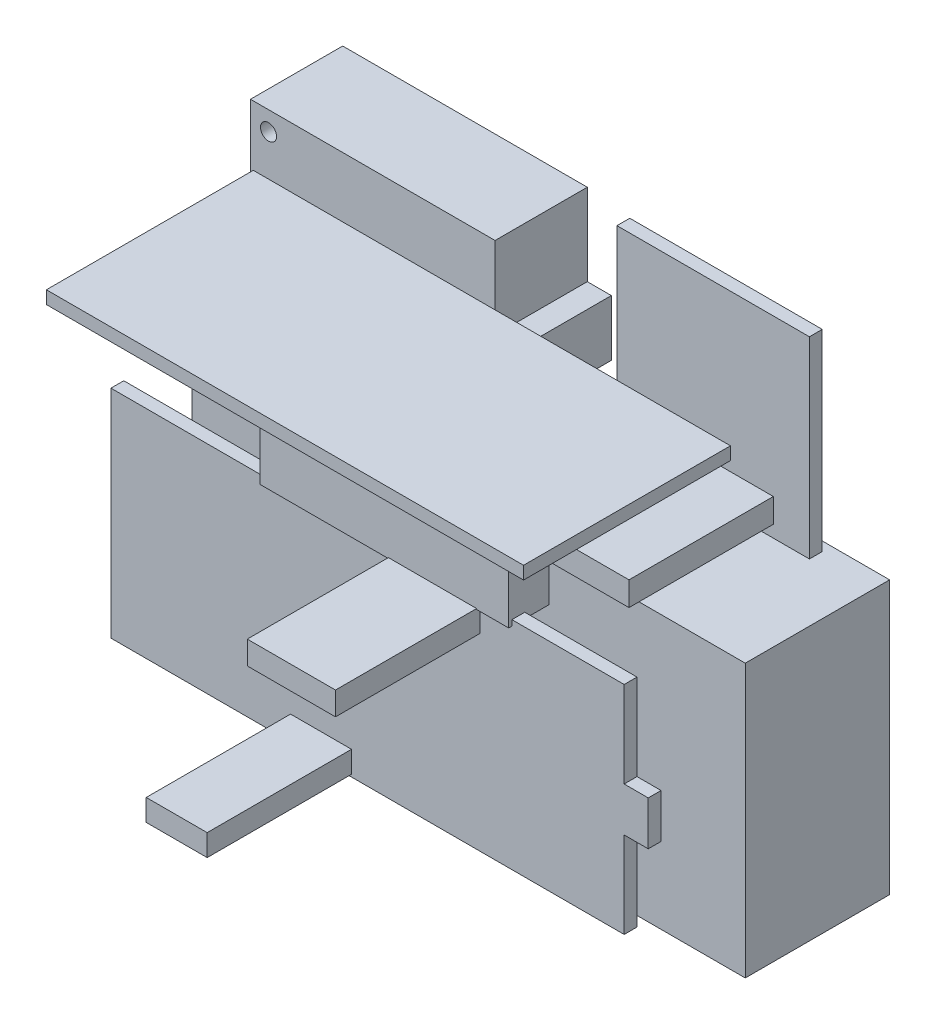
from build123d import *

# Parameters (mm, degrees)
BATTERY_START                              = 4
BATTERY_HOLDER_69_X_34_X_18_PROFILE_W      = 69
BATTERY_HOLDER_69_X_34_X_18_PROFILE_H      = 34
BATTERY_HOLDER_69_X_34_X_18_DEPTH          = 18
YBX_START                                  = 6.4
YBX_BOARD_24_X_24_PROFILE_W                = 24
YBX_BOARD_24_X_24_PROFILE_H                = 24
YBX_BOARD_24_X_24_DEPTH                    = 1.6
YBX_START_2                                = 8
YBX_JUMPER_ALLOWANCE_PROFILE_W             = 15
YBX_JUMPER_ALLOWANCE_PROFILE_H             = 3
YBX_JUMPER_ALLOWANCE_DEPTH                 = 18
GNSS_START                                 = 6.4
GNSS_11_5_MM_HIGH_3_MM_PROJECTION_2_R      = 1
GNSS_11_5_MM_HIGH_3_MM_PROJECTION_D2_DEPTH = 11.5
POWER_START                                = 19.1
POWER_BOARD_59_5_X_25_8_PROFILE_W          = 59.5
POWER_BOARD_59_5_X_25_8_PROFILE_H          = 1.6
POWER_BOARD_59_5_X_25_8_DEPTH              = 25.8
POWER_START_2                              = 30
POWER_HORIZONTAL_CONNECTOR_ALLOWANCE_PRO_W = 31
POWER_HORIZONTAL_CONNECTOR_ALLOWANCE_PRO_H = 16
POWER_HORIZONTAL_CONNECTOR_ALLOWANCE_DEPTH = 5
EORA_START                                 = 33
EORA_64_X_27_TOP_PROJECTION_3_X_5_5_DEPTH  = 1.6
EORA_START_2                               = 34.6
EORA_JUMPER_ALLOWANCE_A_PROFILE_W          = 7.6
EORA_JUMPER_ALLOWANCE_A_PROFILE_H          = 2.7
EORA_JUMPER_ALLOWANCE_A_DEPTH              = 18
EORA_JUMPER_ALLOWANCE_B_PROFILE_W          = 11
EORA_JUMPER_ALLOWANCE_B_PROFILE_H          = 2.9
EORA_JUMPER_ALLOWANCE_B_DEPTH              = 18


with BuildPart() as part:
    # Battery holder 69 x 34 x 18 profile → Battery holder 69 x 34 x 18 (new body)
    with BuildSketch(Plane.XY.offset(BATTERY_START)):
        with Locations((0, -12.75)):
            Rectangle(BATTERY_HOLDER_69_X_34_X_18_PROFILE_W, BATTERY_HOLDER_69_X_34_X_18_PROFILE_H)
    extrude(amount=BATTERY_HOLDER_69_X_34_X_18_DEPTH)


with BuildPart() as body_2:
    # YBX board 24 x 24 profile → YBX board 24 x 24 (new body)
    with BuildSketch(Plane.XY.offset(YBX_START)):
        with Locations((16.5, 17.5)):
            Rectangle(YBX_BOARD_24_X_24_PROFILE_W, YBX_BOARD_24_X_24_PROFILE_H)
    extrude(amount=YBX_BOARD_24_X_24_DEPTH)


with BuildPart() as body_3:
    # YBX jumper allowance profile → YBX jumper allowance (new body)
    with BuildSketch(Plane.XY.offset(YBX_START_2)):
        with Locations((16.5, 8.5)):
            Rectangle(YBX_JUMPER_ALLOWANCE_PROFILE_W, YBX_JUMPER_ALLOWANCE_PROFILE_H)
    extrude(amount=YBX_JUMPER_ALLOWANCE_DEPTH)


with BuildPart() as body_4:
    # GNSS 11.5 mm high - 3 mm projection  2 → GNSS 11.5 mm high - 3 mm projection - D2 (new body)
    with BuildSketch(Plane.XY.offset(GNSS_START)):
        Polygon((-31.3, 4.7), (-0.8, 4.7), (-0.8, 13), (2.2, 13), (2.2, 20), (-0.8, 20), (-0.8, 30.2), (-31.3, 30.2), align=None)
        with Locations((-29.05, 7)):
            Circle(GNSS_11_5_MM_HIGH_3_MM_PROJECTION_2_R, mode=Mode.SUBTRACT)
        with Locations((-29.05, 27.8)):
            Circle(GNSS_11_5_MM_HIGH_3_MM_PROJECTION_2_R, mode=Mode.SUBTRACT)
    extrude(amount=GNSS_11_5_MM_HIGH_3_MM_PROJECTION_D2_DEPTH)


with BuildPart() as body_5:
    # Power board 59.5 x 25.8 profile → Power board 59.5 x 25.8 (new body)
    with BuildSketch(Plane.XY.offset(POWER_START)):
        with Locations((0, 23.1)):
            Rectangle(POWER_BOARD_59_5_X_25_8_PROFILE_W, POWER_BOARD_59_5_X_25_8_PROFILE_H)
    extrude(amount=POWER_BOARD_59_5_X_25_8_DEPTH)


with BuildPart() as body_6:
    # Power horizontal connector allowance profile → Power horizontal connector allowance (new body)
    with BuildSketch(Plane.XY.offset(POWER_START_2)):
        with Locations((2.5, 14.3)):
            Rectangle(POWER_HORIZONTAL_CONNECTOR_ALLOWANCE_PRO_W, POWER_HORIZONTAL_CONNECTOR_ALLOWANCE_PRO_H)
    extrude(amount=POWER_HORIZONTAL_CONNECTOR_ALLOWANCE_DEPTH)


with BuildPart() as body_7:
    # EoRa 64 x 27 - top projection 3 x 5.5 profile → EoRa 64 x 27 - top projection 3 x 5.5 (new body)
    with BuildSketch(Plane.XY.offset(EORA_START)):
        Polygon((-32, -20), (32, -20), (32, -9.25), (35, -9.25), (35, -3.75), (32, -3.75), (32, 7), (-32, 7), align=None)
    extrude(amount=EORA_64_X_27_TOP_PROJECTION_3_X_5_5_DEPTH)


with BuildPart() as body_8:
    # EoRa jumper allowance A profile → EoRa jumper allowance A (new body)
    with BuildSketch(Plane.XY.offset(EORA_START_2)):
        with Locations((-5.8, -18.35)):
            Rectangle(EORA_JUMPER_ALLOWANCE_A_PROFILE_W, EORA_JUMPER_ALLOWANCE_A_PROFILE_H)
    extrude(amount=EORA_JUMPER_ALLOWANCE_A_DEPTH)


with BuildPart() as body_9:
    # EoRa jumper allowance B profile → EoRa jumper allowance B (new body)
    with BuildSketch(Plane.XY.offset(EORA_START_2)):
        with Locations((8.5, 4.95)):
            Rectangle(EORA_JUMPER_ALLOWANCE_B_PROFILE_W, EORA_JUMPER_ALLOWANCE_B_PROFILE_H)
    extrude(amount=EORA_JUMPER_ALLOWANCE_B_DEPTH)


solid = Compound([part.part, body_2.part, body_3.part, body_4.part, body_5.part, body_6.part, body_7.part, body_8.part, body_9.part])
